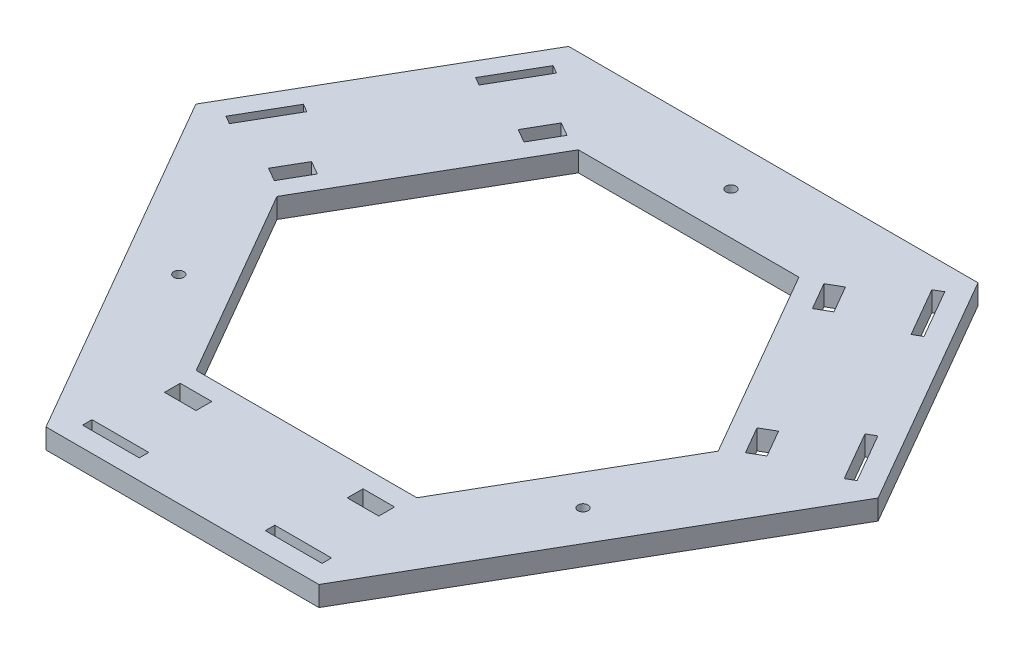
from build123d import *

# Parameters (mm, degrees)
BOSS_EXTRUDE1_DEPTH   = 6.35
SKETCH2_W             = 18
SKETCH2_H             = 3
SKETCH2_W_2           = 10
SKETCH2_H_2           = 5
CUT_EXTRUDE1_DEPTH    = 148.509567486
CUT_EXTRUDE2_DEPTH    = 148.509567486
F_3_0MM_DOWEL_HOLE1_D = 3.2


with BuildPart() as part:
    # Sketch1 → Boss-Extrude1 (new body)
    with BuildSketch(Plane(origin=(0, 0, 0), x_dir=(1, 0, 0), z_dir=(0, 1, 0))):
        Polygon((64.951905284, 87.5), (-64.951905284, 87.5), (-108.253175473, 12.5), (-43.301270189, -100), (43.301270189, -100), (108.253175473, 12.5), align=None)
    extrude(amount=BOSS_EXTRUDE1_DEPTH)

    # Sketch2 → Cut-Extrude1 (cut, through all)
    with BuildSketch(Plane(origin=(0, 6.35, 0), x_dir=(1, 0, 0), z_dir=(0, 1, 0))):
        with Locations((-29, -92.2)):
            Rectangle(SKETCH2_W, SKETCH2_H)
        with Locations((29, -92.2)):
            Rectangle(SKETCH2_W, SKETCH2_H)
        Polygon((-62.146580335, 79.758965344), (-59.548504123, 78.258965344), (-68.548504123, 62.670508076), (-71.146580335, 64.170508076), align=None)
        Polygon((-97.548504123, 12.441034656), (-88.548504123, 28.029491924), (-91.146580335, 29.529491924), (-100.146580335, 13.941034656), align=None)
        Polygon((100.146580335, 13.941034656), (91.146580335, 29.529491924), (88.548504123, 28.029491924), (97.548504123, 12.441034656), align=None)
        Polygon((59.548504123, 78.258965344), (62.146580335, 79.758965344), (71.146580335, 64.170508076), (68.548504123, 62.670508076), align=None)
        with Locations((-29, -69.2)):
            Rectangle(SKETCH2_W_2, SKETCH2_H_2)
        with Locations((29, -69.2)):
            Rectangle(SKETCH2_W_2, SKETCH2_H_2)
        Polygon((79.094021451, 6.405136271), (74.094021451, 15.065390309), (69.763894432, 12.565390309), (74.763894432, 3.905136271), align=None)
        Polygon((40.763894432, 62.794863729), (45.094021451, 65.294863729), (50.094021451, 56.634609691), (45.763894432, 54.134609691), align=None)
        Polygon((-74.763894432, 3.905136271), (-69.763894432, 12.565390309), (-74.094021451, 15.065390309), (-79.094021451, 6.405136271), align=None)
        Polygon((-45.094021451, 65.294863729), (-40.763894432, 62.794863729), (-45.763894432, 54.134609691), (-50.094021451, 56.634609691), align=None)
    extrude(amount=-CUT_EXTRUDE1_DEPTH, mode=Mode.SUBTRACT)

    # Sketch4 → Cut-Extrude2 (cut, through all)
    with BuildSketch(Plane(origin=(0, 6.35, 0), x_dir=(1, 0, 0), z_dir=(0, 1, 0))):
        Polygon((35, -60.621778265), (70, 0), (35, 60.621778265), (-35, 60.621778265), (-70, 0), (-35, -60.621778265), align=None)
    extrude(amount=-CUT_EXTRUDE2_DEPTH, mode=Mode.SUBTRACT)

    # Ø3.0mm Dowel Hole1 (through all)
    with Locations(Plane(origin=(0, 6.35, 0), x_dir=(1, 0, 0), z_dir=(0, 1, 0))):
        with Locations((0, 74.060889132), (-64.138611416, -37.030444566), (64.138611416, -37.030444566)):
            Hole(F_3_0MM_DOWEL_HOLE1_D / 2)


solid = part.part
